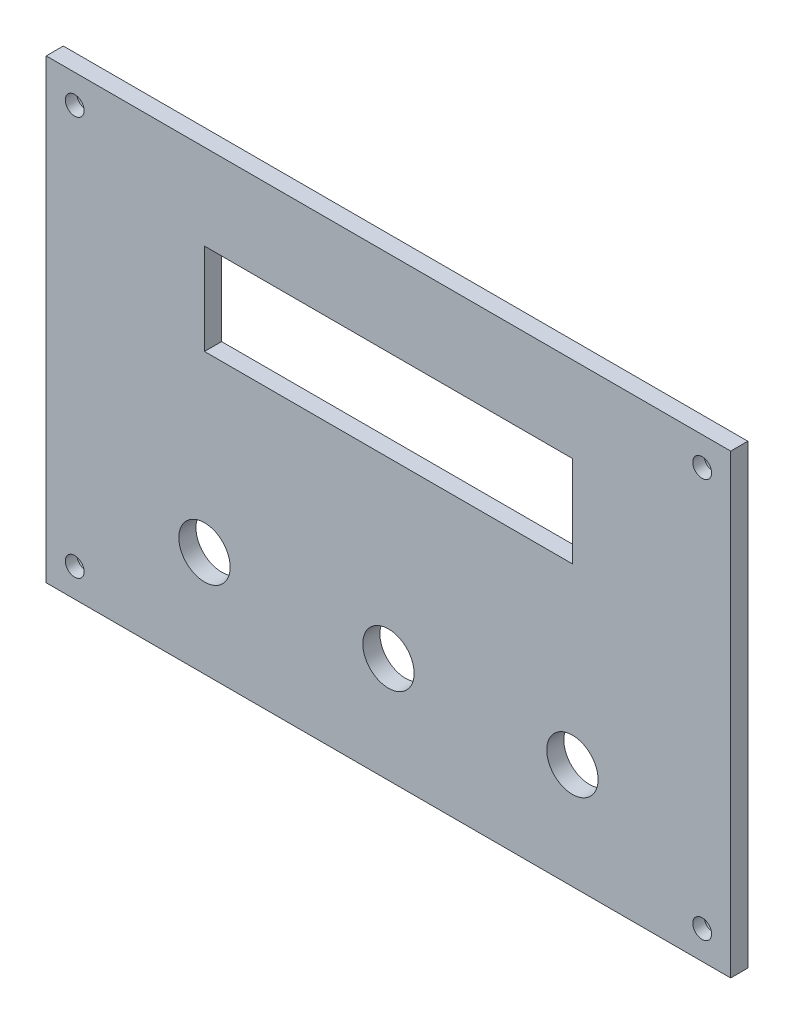
from build123d import *

# Parameters (mm, degrees)
SKICA1_W                 = 120
SKICA1_H                 = 80
P_IDAT_VYSUNUT_M3_DEPTH  = 3
SKICA1_4_OUTSIDE_W       = 150.85
SKICA1_4_OUTSIDE_H       = 110.85
SKICA1_4_OUTSIDE_W_2     = 120
SKICA1_4_OUTSIDE_H_2     = 80
SKICA1_4_OUTSIDE_R       = 4.5
SKICA1_4_OUTSIDE_W_3     = 64.5
SKICA1_4_OUTSIDE_H_3     = 16
ODEBRAT_VYSUNUT_M1_DEPTH = 3
SKICA5_R                 = 1.65
ODEBRAT_VYSUNUT_M3_DEPTH = 2
SKICA6_R                 = 2.5
ODEBRAT_VYSUNUT_M6_DEPTH = 1


with BuildPart() as part:
    # Skica1 → Přidat vysunutím3 (new body)
    with BuildSketch(Plane.XY):
        Rectangle(SKICA1_W, SKICA1_H)
    extrude(amount=P_IDAT_VYSUNUT_M3_DEPTH)

    # Skica1<4> outside → Odebrat vysunutím1 (cut)
    # profile 1 of 5: a face of its own
    with BuildSketch(Plane.XY):
        Rectangle(SKICA1_4_OUTSIDE_W, SKICA1_4_OUTSIDE_H)
        Rectangle(SKICA1_4_OUTSIDE_W_2, SKICA1_4_OUTSIDE_H_2, mode=Mode.SUBTRACT)
    # profile 2 of 5: a face of its own
    with BuildSketch(Plane.XY):
        with Locations((-32.25, -21.5)):
            Circle(SKICA1_4_OUTSIDE_R)
    # profile 3 of 5: a face of its own
    with BuildSketch(Plane.XY):
        with Locations((0, -21.5)):
            Circle(SKICA1_4_OUTSIDE_R)
    # profile 4 of 5: a face of its own
    with BuildSketch(Plane.XY):
        with Locations((32.25, -21.5)):
            Circle(SKICA1_4_OUTSIDE_R)
    # profile 5 of 5: a face of its own
    with BuildSketch(Plane.XY):
        with Locations((0, 17)):
            Rectangle(SKICA1_4_OUTSIDE_W_3, SKICA1_4_OUTSIDE_H_3)
    extrude(amount=ODEBRAT_VYSUNUT_M1_DEPTH, mode=Mode.SUBTRACT)

    # Skica5 → Odebrat vysunutím3 (cut)
    with BuildSketch(Plane.XY.offset(3)):
        with Locations((-55, 35)):
            Circle(SKICA5_R)
        with Locations((55, 35)):
            Circle(SKICA5_R)
        with Locations((-55, -35)):
            Circle(SKICA5_R)
        with Locations((55, -35)):
            Circle(SKICA5_R)
    extrude(amount=-ODEBRAT_VYSUNUT_M3_DEPTH, mode=Mode.SUBTRACT)

    # Skica6 → Odebrat vysunutím6 (cut)
    with BuildSketch(Plane.XY.offset(1)):
        with Locations((-55, 35)):
            Circle(SKICA6_R)
        with Locations((55, 35)):
            Circle(SKICA6_R)
        with Locations((55, -35)):
            Circle(SKICA6_R)
        with Locations((-55, -35)):
            Circle(SKICA6_R)
    extrude(amount=-ODEBRAT_VYSUNUT_M6_DEPTH, mode=Mode.SUBTRACT)


solid = part.part
